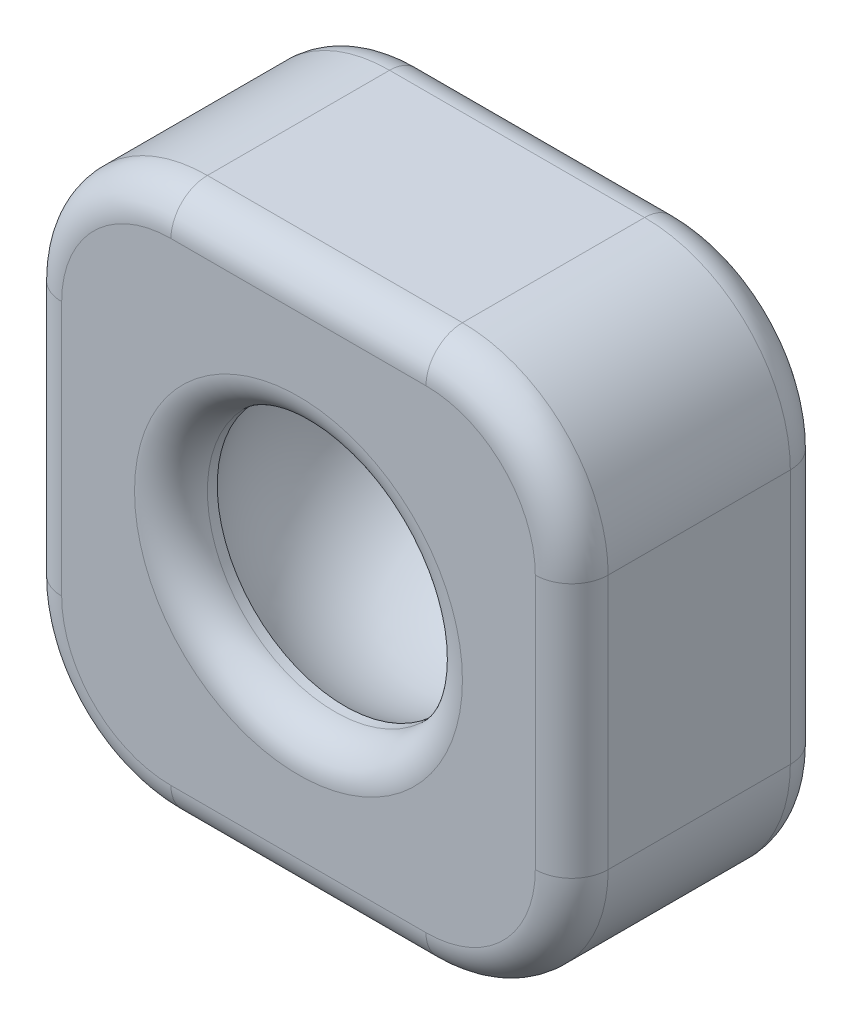
from build123d import *

# Parameters (mm, degrees)
BOSS_EXTRUDE1_DEPTH      = 3.5
BOSS_EXTRUDE1_DEPTH_BACK = 3.5
SKETCH1_W                = 15
SKETCH1_H                = 15
SKETCH1_R                = 3.5
FILLET1_R                = 4
FILLET2_R                = 1


with BuildPart() as part:
    # Sketch1 → Boss-Extrude1 (new, two sides: drawn at the far end of the back side and taken through both)
    with BuildSketch(Plane.XY.offset(5).offset(-BOSS_EXTRUDE1_DEPTH_BACK)):
        Rectangle(SKETCH1_W, SKETCH1_H)
        Circle(SKETCH1_R, mode=Mode.SUBTRACT)
    extrude(amount=BOSS_EXTRUDE1_DEPTH + BOSS_EXTRUDE1_DEPTH_BACK)

    # Sketch2 → Cut-Revolve1 (revolve, cut)
    with BuildSketch(Plane(origin=(0, 0, 0), x_dir=(1, 0, 0), z_dir=(0, 1, 0))):
        with BuildLine():
            Line((3.5, -2.770089688), (3.5, -7.229910312))
            ThreePointArc((3.5, -7.229910312), (4.15, -5), (3.5, -2.770089688))
        make_face()
    revolve(axis=Axis((0, 0, 1.5), (0, 0, 1)), mode=Mode.SUBTRACT)

    # Fillet1
    fillet1_edges = [part.edges().sort_by_distance(p)[0] for p in [
        (-7.5, 7.5, 5),
        (-7.5, -7.5, 5),
        (7.5, 7.5, 5),
        (7.5, -7.5, 5),
    ]]
    fillet(fillet1_edges, radius=FILLET1_R)

    # Fillet2
    fillet2_edges = [part.edges().sort_by_distance(p)[0] for p in [
        (-3.5, 0, 8.5),
        (-6.328427125, -6.328427125, 8.5),
        (-7.5, 0, 8.5),
        (-6.328427125, 6.328427125, 8.5),
        (0, 7.5, 8.5),
        (6.328427125, 6.328427125, 8.5),
        (7.5, 0, 8.5),
        (6.328427125, -6.328427125, 8.5),
        (0, -7.5, 8.5),
        (6.328427125, 6.328427125, 1.5),
        (0, 7.5, 1.5),
        (-6.328427125, 6.328427125, 1.5),
        (-7.5, 0, 1.5),
        (-6.328427125, -6.328427125, 1.5),
        (0, -7.5, 1.5),
        (6.328427125, -6.328427125, 1.5),
        (7.5, 0, 1.5),
        (-3.5, 0, 1.5),
    ]]
    fillet(fillet2_edges, radius=FILLET2_R)


solid = part.part
